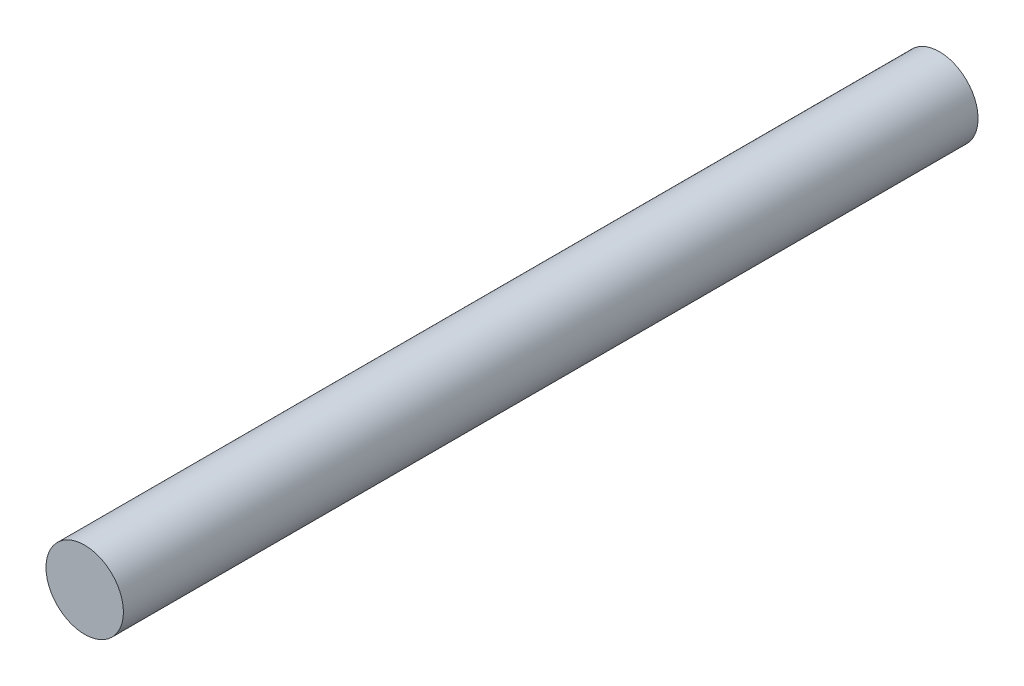
from build123d import *

# Parameters (mm, degrees)
SKETCH_1_R      = 5.25
EXTRUDE_1_DEPTH = 116


with BuildPart() as part:
    # Эскиз1 → Вытянуть1 (new body)
    with BuildSketch(Plane.XY):
        with Locations(Location((0, 0, 0), (0, 0, 180))):
            Circle(SKETCH_1_R)
    extrude(amount=EXTRUDE_1_DEPTH)


solid = part.part
